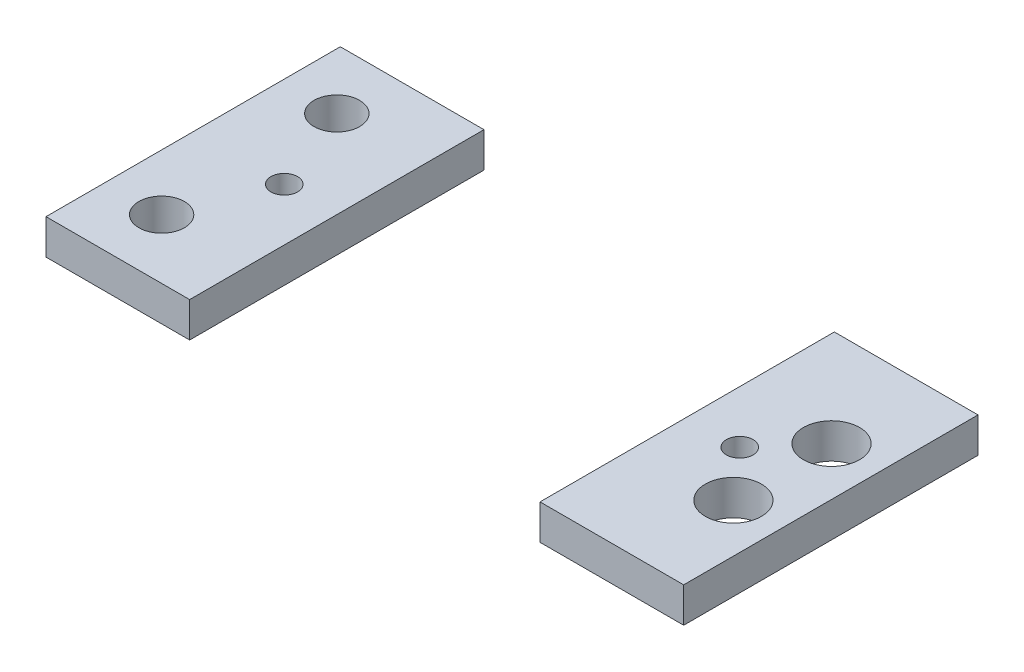
from build123d import *

# Parameters (mm, degrees)
SKETCH_1_W          = 91
SKETCH_1_H          = 42
EXTRUDE_1_DEPTH     = 5
SKETCH_2_R          = 1.75
SKETCH_2_R_2        = 2.25
SKETCH_2_R_3        = 1.9
CUT_EXTRUDE_1_DEPTH = 5
SKETCH_3_R          = 4
SKETCH_3_R_2        = 3.25
CUT_EXTRUDE_2_DEPTH = 5
SKETCH_4_W          = 50
SKETCH_4_H          = 42
CUT_EXTRUDE_3_DEPTH = 10


with BuildPart() as part:
    # 스케치1 → 보스-돌출1 (new body)
    with BuildSketch(Plane(origin=(0, 0, 0), x_dir=(1, 0, 0), z_dir=(0, 1, 0))):
        with Locations((45.5, 21)):
            Rectangle(SKETCH_1_W, SKETCH_1_H)
    extrude(amount=EXTRUDE_1_DEPTH)

    # 스케치2 → 컷-돌출1 (cut)
    with BuildSketch(Plane(origin=(0, 5, 0), x_dir=(1, 0, 0), z_dir=(0, 1, 0))):
        with Locations(Location((28, 33.5, 0), (0, 0, 270))):
            Circle(SKETCH_2_R)
        with Locations(Location((28, 8.5, 0), (0, 0, 270))):
            Circle(SKETCH_2_R)
        with Locations(Location((8, 8.5, 0), (0, 0, 270))):
            Circle(SKETCH_2_R)
        with Locations(Location((8, 33.5, 0), (0, 0, 270))):
            Circle(SKETCH_2_R)
        with Locations(Location((42.094873015, 28, 0), (0, 0, 270))):
            Circle(SKETCH_2_R_2)
        with Locations(Location((42.094873015, 14, 0), (0, 0, 270))):
            Circle(SKETCH_2_R_2)
        with Locations(Location((84.094873015, 14, 0), (0, 0, 270))):
            Circle(SKETCH_2_R_2)
        with Locations(Location((84.094873015, 28, 0), (0, 0, 270))):
            Circle(SKETCH_2_R_2)
        with Locations(Location((78, 21, 0), (0, 0, 270))):
            Circle(SKETCH_2_R_3)
        with Locations(Location((13, 21, 0), (0, 0, 270))):
            Circle(SKETCH_2_R_3)
    extrude(amount=-CUT_EXTRUDE_1_DEPTH, mode=Mode.SUBTRACT)

    # 스케치3 → 컷-돌출2 (cut)
    with BuildSketch(Plane(origin=(0, 5, 0), x_dir=(1, 0, 0), z_dir=(0, 1, 0))):
        with Locations(Location((84.094873015, 28, 0), (0, 0, 270))):
            Circle(SKETCH_3_R)
        with Locations(Location((84.094873015, 14, 0), (0, 0, 270))):
            Circle(SKETCH_3_R)
        with Locations(Location((42.094873015, 14, 0), (0, 0, 270))):
            Circle(SKETCH_3_R)
        with Locations(Location((42.094873015, 28, 0), (0, 0, 270))):
            Circle(SKETCH_3_R)
        with Locations(Location((28, 33.5, 0), (0, 0, 270))):
            Circle(SKETCH_3_R_2)
        with Locations(Location((28, 8.5, 0), (0, 0, 270))):
            Circle(SKETCH_3_R_2)
        with Locations(Location((8, 8.5, 0), (0, 0, 270))):
            Circle(SKETCH_3_R_2)
        with Locations(Location((8, 33.5, 0), (0, 0, 270))):
            Circle(SKETCH_3_R_2)
    extrude(amount=-CUT_EXTRUDE_2_DEPTH, mode=Mode.SUBTRACT)

    # 스케치4 → 컷-돌출3 (cut)
    with BuildSketch(Plane(origin=(0, 5, 0), x_dir=(1, 0, 0), z_dir=(0, 1, 0))):
        with Locations((45.5, 21)):
            Rectangle(SKETCH_4_W, SKETCH_4_H)
    extrude(amount=-CUT_EXTRUDE_3_DEPTH, mode=Mode.SUBTRACT)


with BuildPart() as cut_extrude_3_piece_1:
    # of the separate pieces the step leaves, piece 1, a body of its own (cut_extrude_3_pieces)
    add(part.part.solids().sort_by_distance((0, 0, 0))[0])


with BuildPart() as cut_extrude_3_piece_2:
    # of the separate pieces the step leaves, piece 2, a body of its own (cut_extrude_3_pieces)
    add(part.part.solids().sort_by_distance((70.5, 0, 0))[0])


solid = Compound([cut_extrude_3_piece_1.part, cut_extrude_3_piece_2.part])
